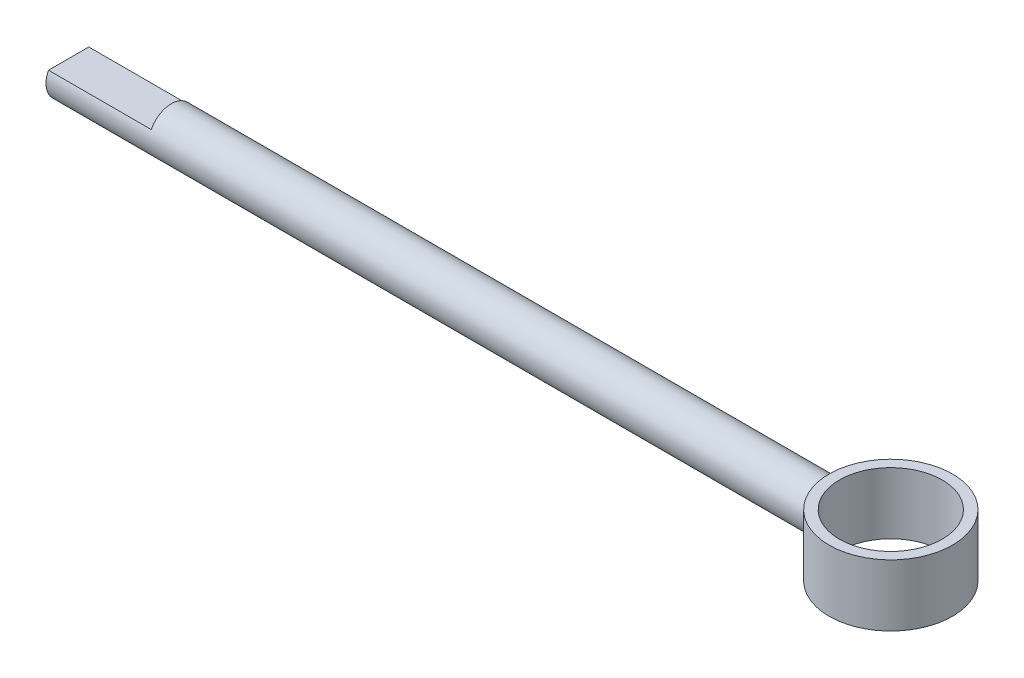
from build123d import *

# Parameters (mm, degrees)
BOSS_EXTRUDE1_DEPTH      = 15
BOSS_EXTRUDE1_DEPTH_BACK = 15
SKETCH1_3_R              = 30.000000000000046
SKETCH2_R                = 25.000000000000007
CUT_EXTRUDE1_DEPTH       = 30
CUT_EXTRUDE2_DEPTH       = 50


with BuildPart() as part:
    # Sketch1 → Revolve1 (revolve)
    with BuildSketch(Plane(origin=(0, 0, 0), x_dir=(1, 0, 0), z_dir=(0, 1, 0))):
        with BuildLine():
            Line((0, 10.999999999999996), (0, 0))
            Line((0, 0), (369.99999999999994, 0))
            ThreePointArc((369.99999999999994, 3.67e-15), (370.5269856969365, 5.598341530437239), (372.0894285260945, 11.000000000000714))
            Line((372.0894285260947, 10.999999999999996), (0, 10.999999999999996))
        make_face()
    revolve(axis=Axis((0, 0, 0), (1, 0, 0)))

    # Sketch1<3> → Boss-Extrude1 (add, two sides: drawn at the far end of the back side and taken through both)
    with BuildSketch(Plane(origin=(0, 0, 0), x_dir=(1, 0, 0), z_dir=(0, 1, 0)).offset(-BOSS_EXTRUDE1_DEPTH_BACK)):
        with Locations((400, -2.132e-14)):
            Circle(SKETCH1_3_R)
    extrude(amount=BOSS_EXTRUDE1_DEPTH + BOSS_EXTRUDE1_DEPTH_BACK)

    # Sketch2 → Cut-Extrude1 (cut)
    with BuildSketch(Plane(origin=(0, 15, 0), x_dir=(1, 0, 0), z_dir=(0, 1, 0))):
        with Locations((400, 0)):
            Circle(SKETCH2_R)
    extrude(amount=-CUT_EXTRUDE1_DEPTH, mode=Mode.SUBTRACT)

    # Sketch3 → Cut-Extrude2 (cut)
    with BuildSketch(Plane.ZY):
        with BuildLine():
            Line((-9.797958971132708, 5), (0, 5))
            Line((0, 5), (9.797958971132708, 5))
            ThreePointArc((9.797958971132708, 5), (6.7e-16, 10.999999999999996), (-9.797958971132706, 5.000000000000003))
        make_face()
    extrude(amount=-CUT_EXTRUDE2_DEPTH, mode=Mode.SUBTRACT)


solid = part.part
